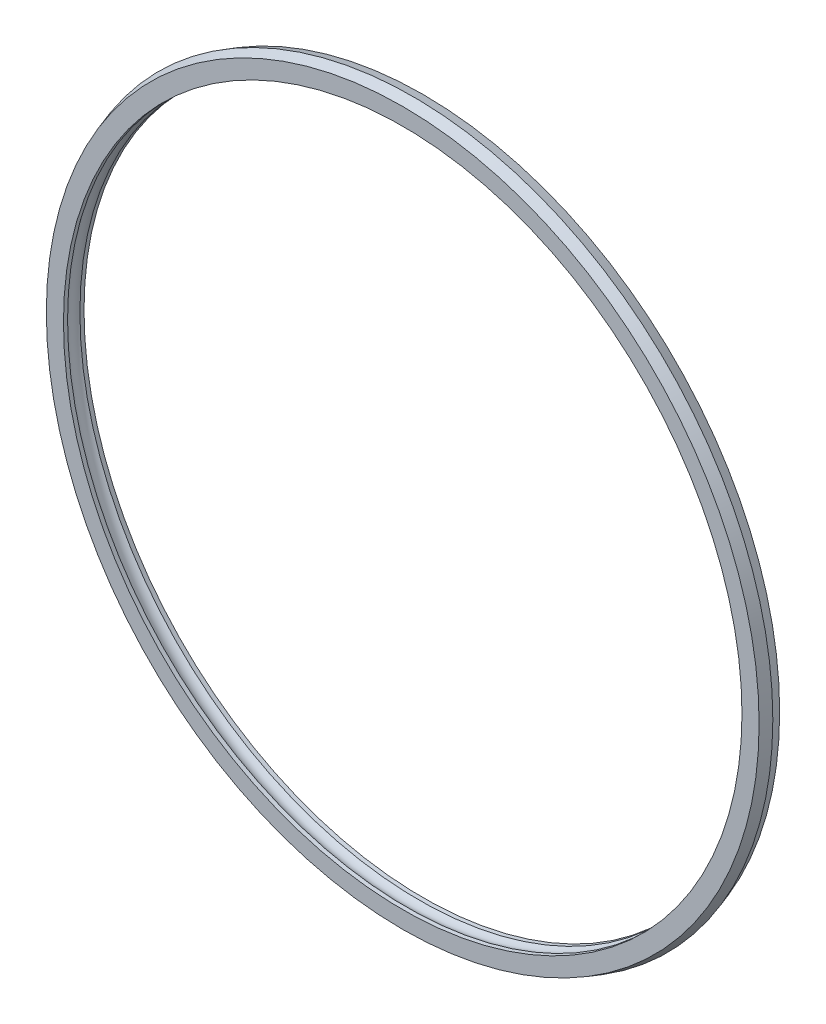
from build123d import *


with BuildPart() as part:
    # Sketch1 → Revolve1 (revolve)
    with BuildSketch(Plane(origin=(0, 0, 0), x_dir=(0, 0, -1), z_dir=(1, 0, 0)), mode=Mode.PRIVATE) as revolve1_sk:
        with BuildLine():
            Line((0, 52.5), (1.5, 52))
            Line((1.5, 52), (1.5, 49.5))
            Line((1.5, 49.5), (0.9, 49.5))
            ThreePointArc((0.9, 49.5), (0, 49.8), (-0.9, 49.5))
            Line((-0.9, 49.5), (-1.5, 49.5))
            Line((-1.5, 49.5), (-1.5, 52))
            Line((-1.5, 52), (0, 52.5))
        make_face()
    revolve(revolve1_sk.sketch.rotate(Axis((0, 0, 0), (0, 0, -1)), 90), axis=Axis((0, 0, 0), (0, 0, -1)))


solid = part.part
